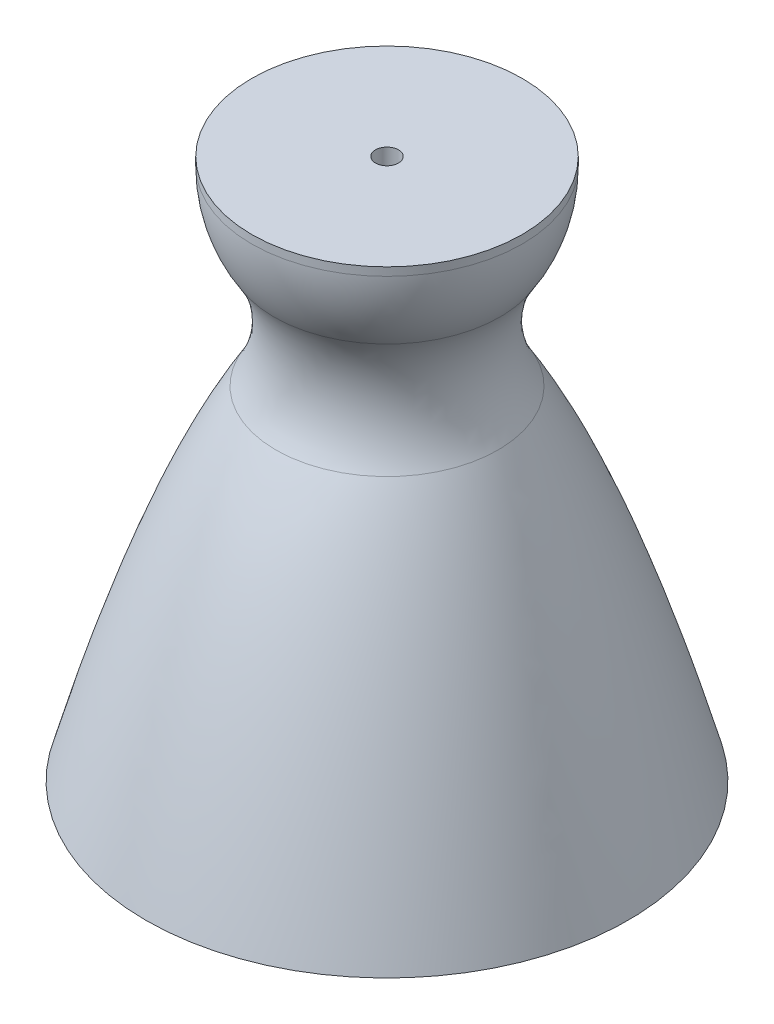
from build123d import *

# Parameters (mm, degrees)
SKETCH6_R          = 4.25
CUT_EXTRUDE1_DEPTH = 237.394879975


with BuildPart() as part:
    # Sketch2 → Revolve1 (revolve)
    with BuildSketch(Plane(origin=(0, 0, 0), x_dir=(0, 0, -1), z_dir=(1, 0, 0))):
        with BuildLine():
            Line((-47, 200), (-47, 196.952633809))
            ThreePointArc((-47, 196.952633809), (-45.020836212, 183.457289916), (-39.250029499, 171.098520319))
            ThreePointArc((-39.250029499, 171.098520319), (-32.165314943, 148.143950557), (-38.499883067, 124.971149691))
            add(Edge.make_bspline(
                [(-38.499883067, 124.971149691), (-39.004530717, 124.147950453), (-39.989837427, 122.509882381), (-41.987103434, 119.066741734), (-44.476625137, 114.542174666), (-47.469272443, 108.73134572), (-51.458823728, 100.486184281), (-56.445386005, 89.243791761), (-62.422969316, 74.260784727), (-68.39139954, 57.78817126), (-73.355476081, 42.822187789), (-77.320473203, 30.10613441), (-80.290300516, 20.200019419), (-82.763970951, 11.629508828), (-84.647070901, 4.923001543), (-85.564233648, 1.602436154), (-85.985445094, 0.065829354), (-86.003484285, -2.71e-07)],
                knots=[0.502863577, 0.502863577, 0.502863577, 0.502863577, 0.502970965, 0.503078353, 0.503293128, 0.503507904, 0.50372268, 0.504152231, 0.504581782, 0.505011333, 0.505440885, 0.50565566, 0.505870436, 0.506085211, 0.506192599, 0.506280364, 0.506284289, 0.506284289, 0.506284289, 0.506284289], degree=3))
            Line((-86.003484285, -2.71e-07), (-89.113801103, 0))
            add(Edge.make_bspline(
                [(-41.057539829, 126.539075674), (-65.366339288, 86.885695354), (-89.113801103, 0)],
                knots=[0, 0, 0, 1, 1, 1], degree=2))
            ThreePointArc((-41.057539829, 126.539075674), (-35.16491832, 148.095169564), (-41.755350531, 169.448257756))
            ThreePointArc((-41.755350531, 169.448257756), (-47.894506608, 182.595884987), (-50, 196.952633809))
            Line((-50, 196.952633809), (-50, 200))
            Line((-50, 200), (-47, 200))
        make_face()
    revolve(axis=Axis((0, 180, 0), (0, -1, 0)))

    # Sketch5 → Revolve2 (revolve)
    with BuildSketch(Plane(origin=(0, 0, 0), x_dir=(0, 0, -1), z_dir=(1, 0, 0)), mode=Mode.PRIVATE) as revolve2_sk:
        with BuildLine():
            Line((-33.861088957, 130.854414053), (-3, 161.71550301))
            Line((-3, 161.71550301), (0, 161.71550301))
            Line((0, 161.71550301), (0, 200))
            Line((0, 200), (-47, 200))
            Line((-47, 200), (-47, 196.952633809))
            ThreePointArc((-47, 196.952633809), (-45.020836212, 183.457289916), (-39.250029499, 171.098520319))
            ThreePointArc((-39.250029499, 171.098520319), (-32.165314943, 148.143950557), (-38.499883067, 124.971149691))
            ThreePointArc((-38.499883067, 124.971149691), (-36.353838994, 128.049465988), (-33.861088957, 130.854414053))
        make_face()
    revolve(revolve2_sk.sketch.rotate(Axis((0, -1000, 0), (0, 1, 0)), 180), axis=Axis((0, -1000, 0), (0, 1, 0)))

    # Sketch6 → Cut-Extrude1 (cut, through all)
    with BuildSketch(Plane(origin=(0, 200, 0), x_dir=(1, 0, 0), z_dir=(0, 1, 0))):
        with Locations(Location((0, 0, 0), (0, 0, 270))):
            Circle(SKETCH6_R)
    extrude(amount=-CUT_EXTRUDE1_DEPTH, mode=Mode.SUBTRACT)


solid = part.part
